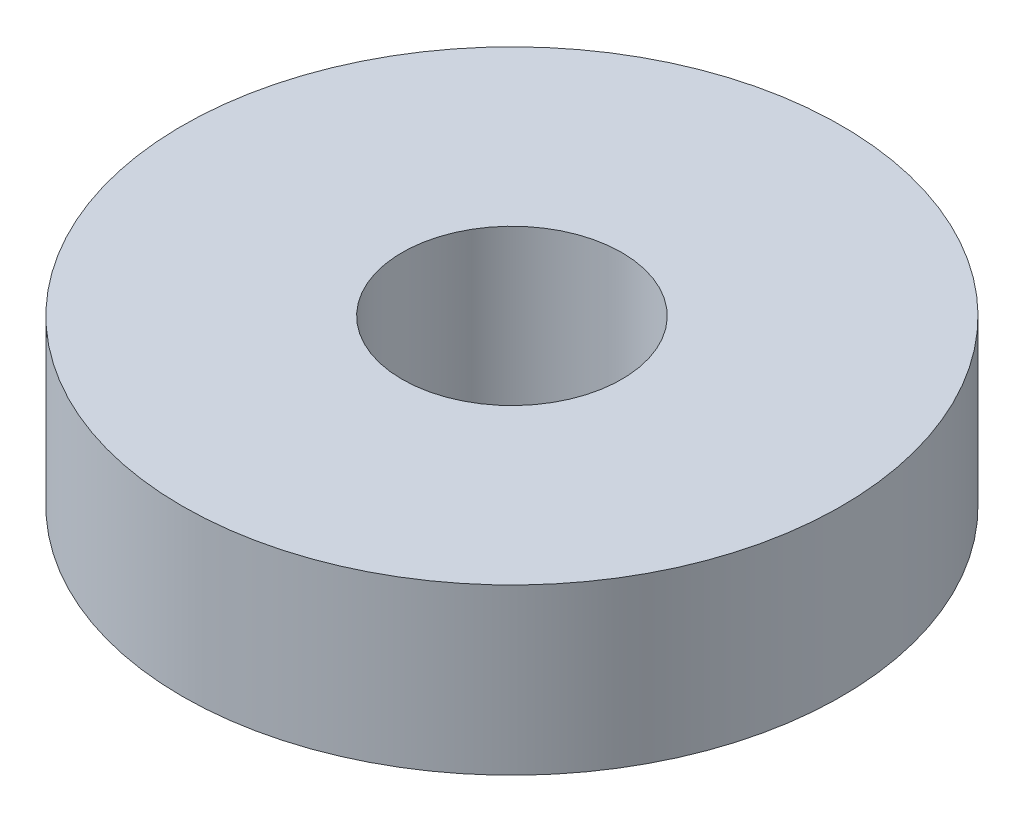
from build123d import *

# Parameters (mm, degrees)
SKETCH1_R           = 12
SKETCH1_R_2         = 4
BOSS_EXTRUDE1_DEPTH = 6


with BuildPart() as part:
    # Sketch1 → Boss-Extrude1 (new body)
    with BuildSketch(Plane(origin=(0, 0, 0), x_dir=(1, 0, 0), z_dir=(0, 1, 0))):
        with Locations(Location((0, 0, 0), (0, 0, 270))):
            Circle(SKETCH1_R)
        with Locations(Location((0, 0, 0), (0, 0, 270))):
            Circle(SKETCH1_R_2, mode=Mode.SUBTRACT)
    extrude(amount=BOSS_EXTRUDE1_DEPTH)


solid = part.part
